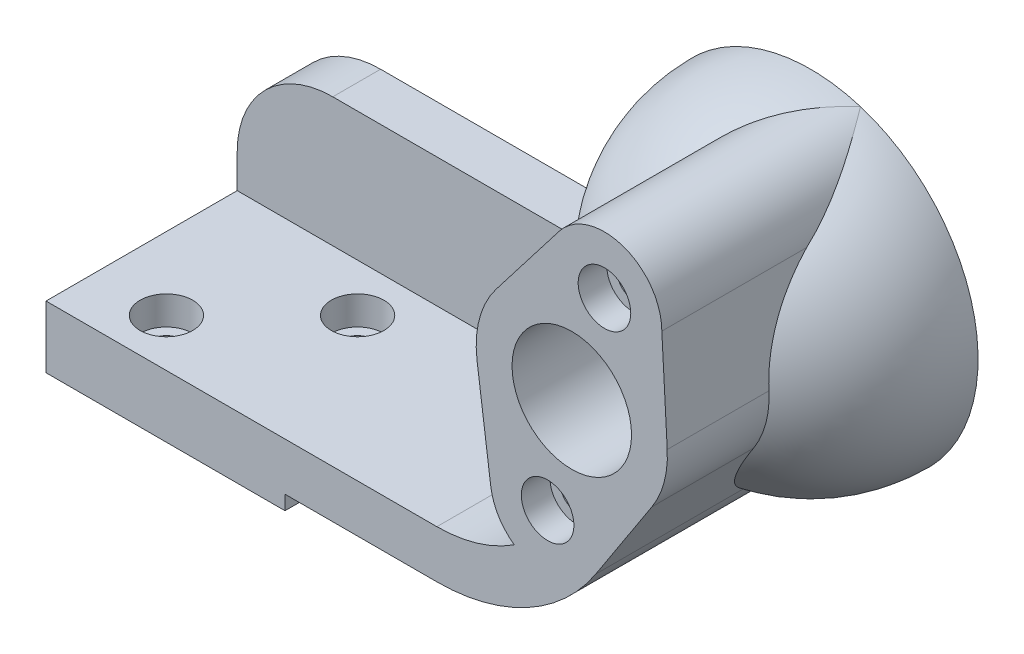
from build123d import *

# Parameters (mm, degrees)
SKETCH1_R           = 12.5
BOSS_EXTRUDE1_DEPTH = 50
SKETCH3_R           = 5.5
CUT_EXTRUDE2_DEPTH  = 6
BOSS_EXTRUDE2_DEPTH = 10
CUT_EXTRUDE3_REACH  = 177.357
SKETCH8_R           = 12.5
SKETCH8_R_2         = 3.3
SKETCH9_R           = 5.5
CUT_EXTRUDE4_DEPTH  = 6
SKETCH11_R          = 3.3
CUT_EXTRUDE5_DEPTH  = 170.437304068


with BuildPart() as part:
    # Sketch1 → Boss-Extrude1 (new body)
    with BuildSketch(Plane.XY):
        with BuildLine():
            Line((0, 13), (0, 0))
            Line((0, 0), (50, 0))
            Line((50, 0), (50, 3))
            Line((50, 3), (81.775930618, 3))
            ThreePointArc((81.775930618, 3), (100.673195021, 7.794200226), (114.99953828, 21.017166857))
            Line((114.99953828, 21.017166857), (126.762369546, 39.090235236))
            ThreePointArc((126.762369546, 39.090235236), (129.32062945, 44.831511086), (129.970641881, 51.083264917))
            Line((129.970641881, 51.083264917), (128.838231587, 71.959931438))
            ThreePointArc((128.838231587, 71.959931438), (120.710453355, 83.318007797), (107.33724849, 79.290096524))
            Line((107.33724849, 79.290096524), (94.165028172, 62.21694181))
            ThreePointArc((94.165028172, 62.21694181), (90.681483474, 55.176380902), (90.178041223, 47.33730395))
            Line((90.178041223, 47.33730395), (93.048941287, 25.965408086))
            ThreePointArc((93.048941287, 25.965408086), (94.65877554, 21.378133023), (97.956410185, 17.805981771))
            ThreePointArc((97.956410185, 17.805981771), (90.215500805, 14.226887077), (81.775930618, 13))
            Line((81.775930618, 13), (0, 13))
        make_face()
        with Locations((110, 50)):
            Circle(SKETCH1_R, mode=Mode.SUBTRACT)
    extrude(amount=BOSS_EXTRUDE1_DEPTH)

    # Sketch3 → Cut-Extrude2 (cut)
    with BuildSketch(Plane.XY.offset(50)):
        with Locations((116.838231587, 71.959931438)):
            Circle(SKETCH3_R)
        with Locations((104.942116553, 27.563025716)):
            Circle(SKETCH3_R)
    extrude(amount=-CUT_EXTRUDE2_DEPTH, mode=Mode.SUBTRACT)

    # Sketch5 → Boss-Extrude2 (add)
    with BuildSketch(Plane(origin=(0, 0, 0), x_dir=(-1, 0, 0), z_dir=(0, 0, -1))):
        with BuildLine():
            Line((-81.775930618, 13), (0, 13))
            Line((0, 13), (0, 20))
            ThreePointArc((0, 20), (-5.857864376, 34.142135624), (-20, 40))
            Line((-20, 40), (-76.458980338, 40))
            Line((-76.458980338, 40), (-80.657198498, 40))
            Line((-80.657198498, 40), (-91.163665826, 40))
            Line((-91.163665826, 40), (-93.048941287, 25.965408086))
            ThreePointArc((-93.048941287, 25.965408086), (-94.65877554, 21.378133023), (-97.956410185, 17.805981771))
            ThreePointArc((-97.956410185, 17.805981771), (-90.215500805, 14.226887077), (-81.775930618, 13))
        make_face()
    extrude(amount=-BOSS_EXTRUDE2_DEPTH)

    # Sketch6 → Revolve2 (revolve)
    with BuildSketch(Plane.ZY.offset(-110)):
        with BuildLine():
            ThreePointArc((35, 50), (24.748737342, 74.748737342), (0, 85))
            Line((0, 85), (0, 50))
            Line((0, 50), (35, 50))
        make_face()
    revolve(axis=Axis((110, 50, 35), (0, 0, -1)))

    # Sketch6<5> → Cut-Revolve3 (revolve, cut)
    with BuildSketch(Plane.ZY.offset(-110)):
        with BuildLine():
            ThreePointArc((31, 50), (21.920310217, 71.920310217), (0, 81))
            Line((0, 81), (0, 50))
            Line((0, 50), (31, 50))
        make_face()
    revolve(axis=Axis((110, 50, 35), (0, 0, -1)), mode=Mode.SUBTRACT)

    # Sketch8 → Cut-Extrude3 (cut, up to next)
    with BuildSketch(Plane.XY.offset(50), mode=Mode.PRIVATE) as cut_extrude3_sk1:
        with Locations((110, 50)):
            Circle(SKETCH8_R)
    cut_extrude3_tool1 = extrude(cut_extrude3_sk1.sketch, amount=-CUT_EXTRUDE3_REACH, mode=Mode.PRIVATE) & part.part
    # Sketch8 → Cut-Extrude3 (cut, up to next)
    with BuildSketch(Plane.XY.offset(50), mode=Mode.PRIVATE) as cut_extrude3_sk2:
        with Locations((116.838231587, 71.959931438)):
            Circle(SKETCH8_R_2)
    cut_extrude3_tool2 = extrude(cut_extrude3_sk2.sketch, amount=-CUT_EXTRUDE3_REACH, mode=Mode.PRIVATE) & part.part
    # Sketch8 → Cut-Extrude3 (cut, up to next)
    with BuildSketch(Plane.XY.offset(50), mode=Mode.PRIVATE) as cut_extrude3_sk3:
        with Locations((104.942116553, 27.563025716)):
            Circle(SKETCH8_R_2)
    cut_extrude3_tool3 = extrude(cut_extrude3_sk3.sketch, amount=-CUT_EXTRUDE3_REACH, mode=Mode.PRIVATE) & part.part
    add(cut_extrude3_tool1.solids().sort_by_distance((110, 50, 50))[0], mode=Mode.SUBTRACT)
    add(cut_extrude3_tool2.solids().sort_by_distance((116.838232, 71.959931, 50))[0], mode=Mode.SUBTRACT)
    add(cut_extrude3_tool3.solids().sort_by_distance((104.942117, 27.563026, 50))[0], mode=Mode.SUBTRACT)

    # Sketch9 → Cut-Extrude4 (cut)
    with BuildSketch(Plane(origin=(0, 13, 0), x_dir=(1, 0, 0), z_dir=(0, 1, 0))):
        with Locations((15.190815531, -40)):
            Circle(SKETCH9_R)
        with Locations((35.190815531, -20)):
            Circle(SKETCH9_R)
    extrude(amount=-CUT_EXTRUDE4_DEPTH, mode=Mode.SUBTRACT)

    # Sketch11 → Cut-Extrude5 (cut, through all)
    with BuildSketch(Plane(origin=(0, 13, 0), x_dir=(1, 0, 0), z_dir=(0, 1, 0))):
        with Locations((35.190815531, -20)):
            Circle(SKETCH11_R)
        with Locations((15.190815531, -40)):
            Circle(SKETCH11_R)
    extrude(amount=-CUT_EXTRUDE5_DEPTH, mode=Mode.SUBTRACT)


solid = part.part
